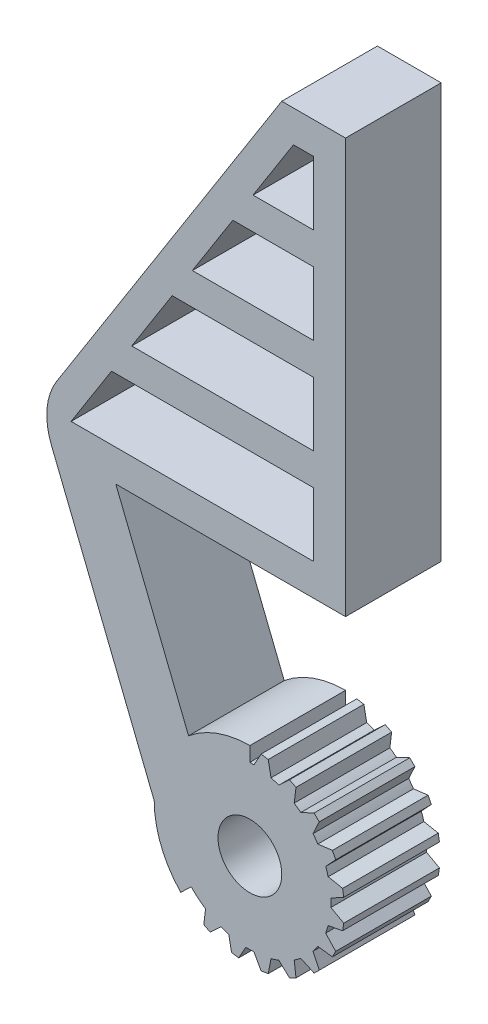
from build123d import *

# Parameters (mm, degrees)
SKETCH1_R           = 5
BOSS_EXTRUDE1_DEPTH = 15
CUT_EXTRUDE1_START  = -15
CUT_EXTRUDE1_DEPTH  = 15
BOSS_EXTRUDE2_START = -15
BOSS_EXTRUDE2_DEPTH = 15
FILLET1_R           = 10


with BuildPart() as part:
    # Sketch1 → Boss-Extrude1 (new body)
    with BuildSketch(Plane.XY):
        with BuildLine():
            Line((0, 0), (-10, 0))
            Line((-10, 0), (-48.033043506, -60))
            Line((-48.033043506, -60), (-30, -105))
            ThreePointArc((-30, -105), (-1.41305071, -111.355691072), (-24.614025467, -93.486073028))
            Line((-24.614025467, -93.486073028), (-36.029372005, -65))
            Line((-36.029372005, -65), (0, -65))
            Line((0, -65), (0, 0))
        make_face()
        Polygon((-5, -50), (-5, -60), (-43.033043506, -60), (-36.694202922, -50), align=None, mode=Mode.SUBTRACT)
        Polygon((-27.185942045, -35), (-5, -35), (-5, -45), (-33.52478263, -45), align=None, mode=Mode.SUBTRACT)
        Polygon((-17.677681169, -20), (-5, -20), (-5, -30), (-24.016521753, -30), align=None, mode=Mode.SUBTRACT)
        Polygon((-14.508260877, -15), (-8.169420292, -5), (-5, -5), (-5, -15), align=None, mode=Mode.SUBTRACT)
        with Locations((-15, -105)):
            Circle(SKETCH1_R, mode=Mode.SUBTRACT)
    extrude(amount=BOSS_EXTRUDE1_DEPTH)

    # Sketch2 → Cut-Extrude1 (cut)
    with BuildSketch(Plane.XY.offset(15).offset(CUT_EXTRUDE1_START)):
        with BuildLine():
            Line((-15, -90), (-15, -92.5))
            ThreePointArc((-15, -92.5), (-3.506810704, -109.914936399), (-24.038127106, -113.634944031))
            Line((-24.038127106, -113.634944031), (-25.845752528, -115.361932837))
            ThreePointArc((-25.845752528, -115.361932837), (-1.208172845, -110.897923679), (-15, -90))
        make_face()
    extrude(amount=CUT_EXTRUDE1_DEPTH, mode=Mode.SUBTRACT)

    # Sketch3 → Boss-Extrude2 (add)
    with BuildSketch(Plane.XY.offset(15).offset(BOSS_EXTRUDE2_START)):
        with BuildLine():
            ThreePointArc((-10.467166144, -93.116837157), (-11.06981717, -92.904141005), (-11.682391753, -92.721986422))
            Line((-11.682391753, -92.721986422), (-12.122200649, -90.45579864))
            Line((-12.122200649, -90.45579864), (-13.242544435, -90.278353616))
            Line((-13.242544435, -90.278353616), (-14.361118089, -92.29771785))
            ThreePointArc((-14.361118089, -92.29771785), (-14.499431062, -92.291515722), (-14.637803355, -92.286819615))
            ThreePointArc((-14.637803355, -92.286819615), (-14.818883312, -92.282950867), (-15, -92.281661197))
            Line((-15, -92.281661197), (-15, -92.5))
            ThreePointArc((-15, -92.5), (-3.506810704, -109.914936399), (-24.038127106, -113.634944031))
            Line((-24.038127106, -113.634944031), (-24.195997015, -113.785771498))
            ThreePointArc((-24.195997015, -113.785771498), (-23.126415999, -114.783532334), (-21.949347795, -115.651887492))
            Line((-21.949347795, -115.651887492), (-22.231355215, -117.943068572))
            Line((-22.231355215, -117.943068572), (-21.220678485, -118.458034088))
            Line((-21.220678485, -118.458034088), (-19.532833856, -116.883162843))
            ThreePointArc((-19.532833856, -116.883162843), (-18.93018283, -117.095858995), (-18.317608247, -117.278013578))
            Line((-18.317608247, -117.278013578), (-17.877799351, -119.54420136))
            Line((-17.877799351, -119.54420136), (-16.757455565, -119.721646384))
            Line((-16.757455565, -119.721646384), (-15.638881911, -117.70228215))
            ThreePointArc((-15.638881911, -117.70228215), (-15, -117.718338803), (-14.361118089, -117.70228215))
            Line((-14.361118089, -117.70228215), (-13.242544435, -119.721646384))
            Line((-13.242544435, -119.721646384), (-12.12220065, -119.544201361))
            Line((-12.12220065, -119.544201361), (-11.682391753, -117.278013578))
            ThreePointArc((-11.682391753, -117.278013578), (-11.06981717, -117.095858995), (-10.467166144, -116.883162843))
            Line((-10.467166144, -116.883162843), (-8.779321515, -118.458034088))
            Line((-8.779321515, -118.458034088), (-7.768644785, -117.943068573))
            Line((-7.768644785, -117.943068573), (-8.050652205, -115.651887492))
            ThreePointArc((-8.050652205, -115.651887492), (-7.524348018, -115.289352232), (-7.016919559, -114.900836762))
            Line((-7.016919559, -114.900836762), (-4.925021947, -115.877055647))
            Line((-4.925021947, -115.877055647), (-4.122944353, -115.074978053))
            Line((-4.122944353, -115.074978053), (-5.099163238, -112.983080441))
            ThreePointArc((-5.099163238, -112.983080441), (-4.710647768, -112.475651982), (-4.348112508, -111.949347795))
            Line((-4.348112508, -111.949347795), (-2.056931428, -112.231355215))
            Line((-2.056931428, -112.231355215), (-1.541965913, -111.220678485))
            Line((-1.541965913, -111.220678485), (-3.116837157, -109.532833856))
            ThreePointArc((-3.116837157, -109.532833856), (-2.904141005, -108.93018283), (-2.721986422, -108.317608247))
            Line((-2.721986422, -108.317608247), (-0.45579864, -107.877799351))
            Line((-0.45579864, -107.877799351), (-0.278353616, -106.757455565))
            Line((-0.278353616, -106.757455565), (-2.29771785, -105.638881911))
            ThreePointArc((-2.29771785, -105.638881911), (-2.281661197, -105), (-2.29771785, -104.361118089))
            Line((-2.29771785, -104.361118089), (-0.278353616, -103.242544435))
            Line((-0.278353616, -103.242544435), (-0.45579864, -102.122200649))
            Line((-0.45579864, -102.122200649), (-2.721986422, -101.682391753))
            ThreePointArc((-2.721986422, -101.682391753), (-2.904141005, -101.06981717), (-3.116837157, -100.467166144))
            Line((-3.116837157, -100.467166144), (-1.541965912, -98.779321515))
            Line((-1.541965912, -98.779321515), (-2.056931427, -97.768644785))
            Line((-2.056931427, -97.768644785), (-4.348112508, -98.050652205))
            ThreePointArc((-4.348112508, -98.050652205), (-4.710647768, -97.524348018), (-5.099163238, -97.016919559))
            Line((-5.099163238, -97.016919559), (-4.122944353, -94.925021947))
            Line((-4.122944353, -94.925021947), (-4.925021947, -94.122944353))
            Line((-4.925021947, -94.122944353), (-7.016919559, -95.099163238))
            ThreePointArc((-7.016919559, -95.099163238), (-7.524348018, -94.710647768), (-8.050652205, -94.348112508))
            Line((-8.050652205, -94.348112508), (-7.768644785, -92.056931428))
            Line((-7.768644785, -92.056931428), (-8.779321515, -91.541965912))
            Line((-8.779321515, -91.541965912), (-10.467166144, -93.116837157))
        make_face()
    extrude(amount=BOSS_EXTRUDE2_DEPTH)

    # Fillet1
    fillet1_edges = [part.edges().sort_by_distance(p)[0] for p in [
        (-48.033043506, -60, 7.5),
    ]]
    fillet(fillet1_edges, radius=FILLET1_R)


solid = part.part
